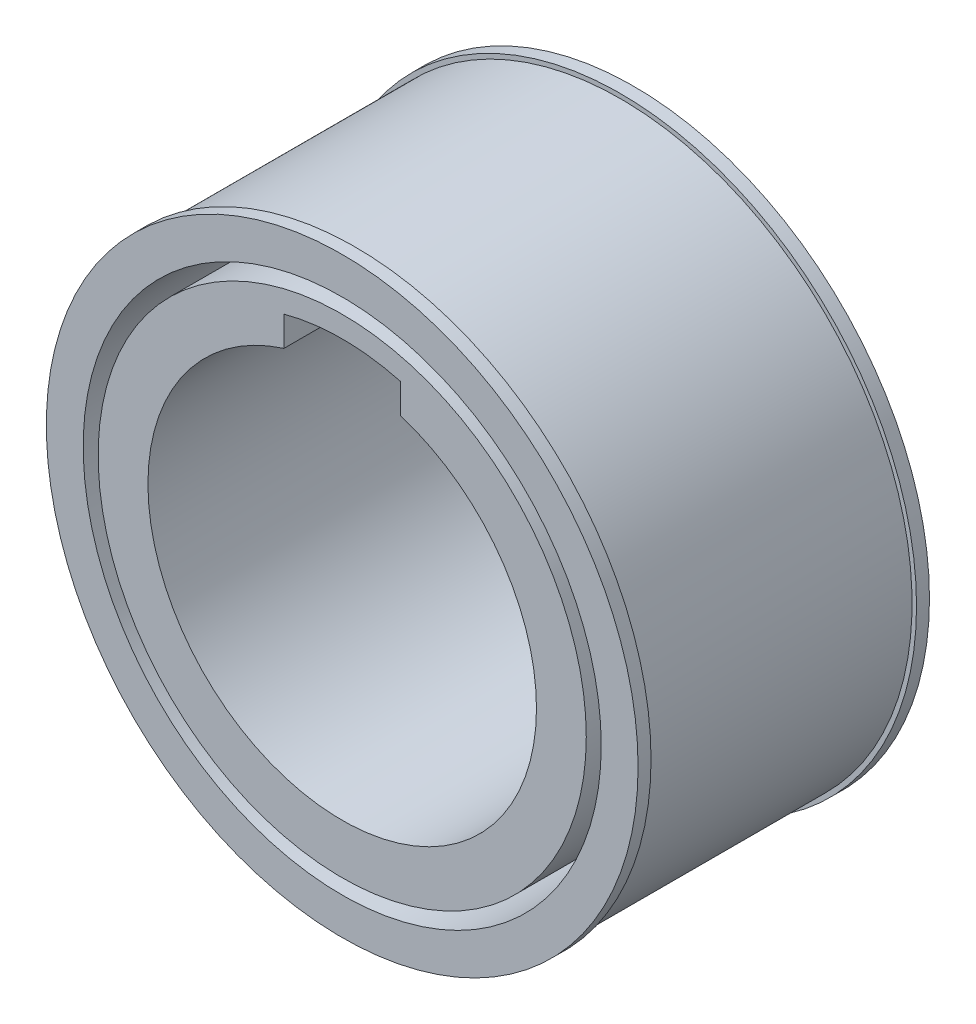
from build123d import *

# Parameters (mm, degrees)
SKETCH1_R               = 45
BOSS_EXTRUDE1_DEPTH     = 22.5
SKETCH2_R               = 45.69
BOSS_EXTRUDE2_DEPTH     = 2
SKETCH4_R               = 40
SKETCH4_R_2             = 37.69
CUT_EXTRUDE1_DEPTH      = 30
CUT_EXTRUDE2_DEPTH      = 79.741045205
CUT_EXTRUDE2_DEPTH_BACK = 79.741045205
SKETCH5_R               = 30
CUT_EXTRUDE3_DEPTH      = 79.741045205


with BuildPart() as part:
    # Sketch1 → Boss-Extrude1 (new, symmetric)
    with BuildSketch(Plane.XY):
        with Locations(Location((0, 0, 0), (0, 0, 180))):
            Circle(SKETCH1_R)
    extrude(amount=BOSS_EXTRUDE1_DEPTH, both=True)

    # Sketch2 → Boss-Extrude2 (add)
    with BuildSketch(Plane.XY.offset(22.5)):
        Circle(SKETCH2_R)
    boss_extrude2 = extrude(amount=-BOSS_EXTRUDE2_DEPTH)

    # Mirror1: Boss-Extrude2 across plane
    add(boss_extrude2.mirror(Plane.XY))

    # Sketch4 → Cut-Extrude1 (cut)
    with BuildSketch(Plane.XY):
        Circle(SKETCH4_R)
        Circle(SKETCH4_R_2, mode=Mode.SUBTRACT)
    extrude(amount=CUT_EXTRUDE1_DEPTH, mode=Mode.SUBTRACT)

    # Sketch5 → Cut-Extrude2 (cut, two sides: drawn at the far end of the back side and taken through both)
    with BuildSketch(Plane.XY.offset(22.5).offset(-CUT_EXTRUDE2_DEPTH_BACK)):
        Circle(SKETCH5_R)
    extrude(amount=CUT_EXTRUDE2_DEPTH + CUT_EXTRUDE2_DEPTH_BACK, mode=Mode.SUBTRACT)

    # Sketch6 → Cut-Extrude3 (cut, through all)
    with BuildSketch(Plane.XY.offset(22.5)):
        with BuildLine():
            Line((9, 20.17408731), (9, 33.20180718))
            ThreePointArc((9, 33.20180718), (0, 34.4), (-9, 33.20180718))
            Line((-9, 33.20180718), (-9, 20.17408731))
            Line((-9, 20.17408731), (9, 20.17408731))
        make_face()
    extrude(amount=-CUT_EXTRUDE3_DEPTH, mode=Mode.SUBTRACT)


solid = part.part
